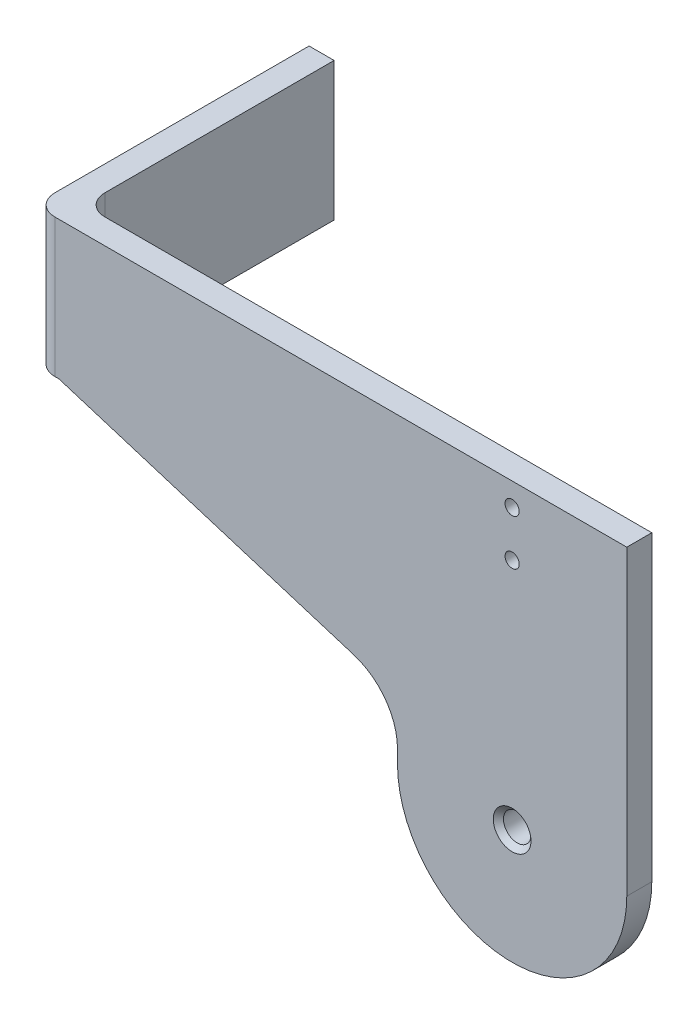
from build123d import *

# Parameters (mm, degrees)
ESTRUSIONE_ESTRUSIONE1_DEPTH                 = 6
SCHIZZO3_W                                   = 136.2
SCHIZZO3_H                                   = 72.5
ESTRUSIONE_ESTRUSIONE2_DEPTH                 = 6
TAGLIO_ESTRUSIONE1_DEPTH                     = 131.797324132
RACCORDO5_R                                  = 15
ESTRUSIONE_ESTRUSIONE5_DEPTH                 = 6
ESTRUSIONE_ESTRUSIONE5_DEPTH_BACK            = 60
SCHIZZO9_W                                   = 6
SCHIZZO9_H                                   = 33.15279029
RACCORDO6_R                                  = 5
RACCORDO7_R                                  = 5
FORO_FILETTATO_G1_16_1_D                     = 6.6
FORO_FILETTATO_G1_16_1_CSINK_D               = 9.05
FORO_FILETTATO_G1_16_1_CSINK_ANGLE           = 90
FORO_LAMATO_PER_BULLONE_M3_A_TESTA_E_2_COUNT = 2
FORO_LAMATO_PER_BULLONE_M3_A_TESTA_E_2_PITCH = 10.95


with BuildPart() as part:
    # Schizzo2 → Estrusione-Estrusione1 (new body)
    with BuildSketch(Plane.XY):
        with BuildLine():
            Line((-27.5, 0), (-27.5, 45))
            ThreePointArc((-27.5, 45), (0, 72.5), (27.5, 45))
            Line((27.5, 45), (27.5, 0))
            ThreePointArc((27.5, 0), (0, -27.5), (-27.5, 0))
        make_face()
    extrude(amount=ESTRUSIONE_ESTRUSIONE1_DEPTH)

    # Schizzo3 → Estrusione-Estrusione2 (add)
    with BuildSketch(Plane.XY):
        with Locations((-40.6, 36.25)):
            Rectangle(SCHIZZO3_W, SCHIZZO3_H)
    extrude(amount=ESTRUSIONE_ESTRUSIONE2_DEPTH)

    # Schizzo4 → Taglio-Estrusione1 (cut, through all)
    with BuildSketch(Plane.XY.offset(6)):
        Polygon((-27.5, 0), (-108.7, 0), (-108.7, 39.34720971), (-27.5, 14.142426235), align=None)
    extrude(amount=-TAGLIO_ESTRUSIONE1_DEPTH, mode=Mode.SUBTRACT)

    # Raccordo5
    raccordo5_edges = [part.edges().sort_by_distance(p)[0] for p in [
        (-27.5, 14.142426235, 3),
    ]]
    fillet(raccordo5_edges, radius=RACCORDO5_R)

    # Schizzo9 → Estrusione-Estrusione5 (add, two sides: drawn at the far end of the back side and taken through both)
    with BuildSketch(Plane.XY.offset(-ESTRUSIONE_ESTRUSIONE5_DEPTH_BACK)):
        with Locations((-111.7, 55.923604855)):
            Rectangle(SCHIZZO9_W, SCHIZZO9_H)
    extrude(amount=ESTRUSIONE_ESTRUSIONE5_DEPTH + ESTRUSIONE_ESTRUSIONE5_DEPTH_BACK)

    # Raccordo6
    raccordo6_edges = [part.edges().sort_by_distance(p)[0] for p in [
        (-108.7, 55.923604855, 0),
    ]]
    fillet(raccordo6_edges, radius=RACCORDO6_R)

    # Raccordo7
    raccordo7_edges = [part.edges().sort_by_distance(p)[0] for p in [
        (-114.7, 55.923604855, 6),
    ]]
    fillet(raccordo7_edges, radius=RACCORDO7_R)

    # Foro filettato G1/16-1 (through all)
    with Locations(Plane.XY.offset(6)):
        with Locations((0, 0)):
            CounterSinkHole(FORO_FILETTATO_G1_16_1_D / 2, FORO_FILETTATO_G1_16_1_CSINK_D / 2, counter_sink_angle=FORO_FILETTATO_G1_16_1_CSINK_ANGLE)

    # Schizzo20 → Foro lamato per Bullone M3 a testa esagonale-3 (revolve, cut)
    with BuildSketch(Plane(origin=(0, 67, 0), x_dir=(0, 1, 0), z_dir=(1, 0, 0))):
        Polygon((0, 0), (0, 6), (1.7, 6), (1.7, 0.5), (4.5, 0.5), (4.5, 0.025), (4.525, 0), align=None)
    foro_lamato_per_bullone_m3_a_testa_esago = revolve(axis=Axis((0, 67, -6.35), (0, 0, 1)), mode=Mode.SUBTRACT)

    # Foro lamato per Bullone M3 a testa e 2: Foro lamato per Bullone M3 a testa esagonale-3 ×2
    with Locations(*[(0, -i * FORO_LAMATO_PER_BULLONE_M3_A_TESTA_E_2_PITCH, 0) for i in range(1, FORO_LAMATO_PER_BULLONE_M3_A_TESTA_E_2_COUNT)]):
        add(foro_lamato_per_bullone_m3_a_testa_esago, mode=Mode.SUBTRACT)


solid = part.part
